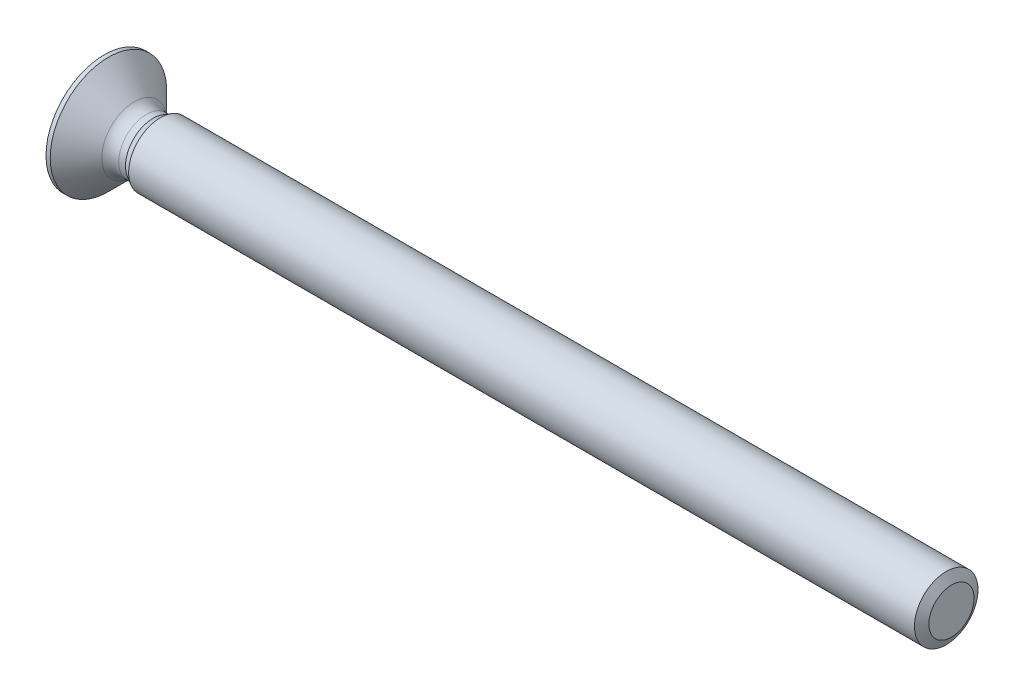
from build123d import *

# Parameters (mm, degrees)
PATTERN_CIRCULAR_1_COUNT = 2
PATTERN_CIRCULAR_1_ANGLE = 90


with BuildPart() as part:
    # 草图1 → Revolve 694 (revolve)
    with BuildSketch(Plane.XY, mode=Mode.PRIVATE) as revolve_694_sk:
        with BuildLine():
            Line((0, 0), (0, 2.75))
            Line((0, 2.75), (0.199, 2.75))
            Line((0.199, 2.75), (1.415685425, 1.533314575))
            ThreePointArc((1.415685425, 1.533314575), (1.675224104, 1.359896374), (1.98137085, 1.299))
            Line((1.98137085, 1.299), (2.301857788, 1.299))
            Line((2.301857788, 1.299), (2.65, 1.5))
            Line((2.65, 1.5), (40, 1.5))
            Line((40, 1.5), (40, 0))
            Line((40, 0), (0, 0))
        make_face()
    revolve(revolve_694_sk.sketch.rotate(Axis((0, 0, 0), (1, 0, 0)), 90), axis=Axis((0, 0, 0), (1, 0, 0)))

    # 草图2 → 切除-旋转1 (revolve, cut)
    with BuildSketch(Plane.XY, mode=Mode.PRIVATE) as cut_revolve_1_sk:
        Polygon((39.752708003, 1.5), (40.252708003, 1.5), (40, 1.067), align=None)
    revolve(cut_revolve_1_sk.sketch.rotate(Axis((0, 0, 0), (-1, 0, 0)), 270), axis=Axis((0, 0, 0), (-1, 0, 0)), mode=Mode.SUBTRACT)

    # 草图3 → 切除-放样1 section 0
    with BuildSketch(Plane.ZY, mode=Mode.PRIVATE) as loft_1_s0:
        with BuildLine():
            Line((-1.6, 0.25), (1.6, 0.25))
            Line((1.6, 0.25), (1.6, -0.25))
            Line((1.6, -0.25), (-1.6, -0.25))
            Line((-1.6, -0.25), (-1.6, 0.25))
        make_face()
    loft_1 = loft([loft_1_s0.sketch, Vertex(2.1, 0, 0)], mode=Mode.SUBTRACT)

    # 阵列(圆周)1: 切除-放样1 ×2 about axis
    pattern_circular_1_axis = Axis((0, 0, 0), (1, 0, 0))
    for i in range(1, PATTERN_CIRCULAR_1_COUNT):
        add(loft_1.rotate(pattern_circular_1_axis, i * PATTERN_CIRCULAR_1_ANGLE / (PATTERN_CIRCULAR_1_COUNT - 1)), mode=Mode.SUBTRACT)


solid = part.part
